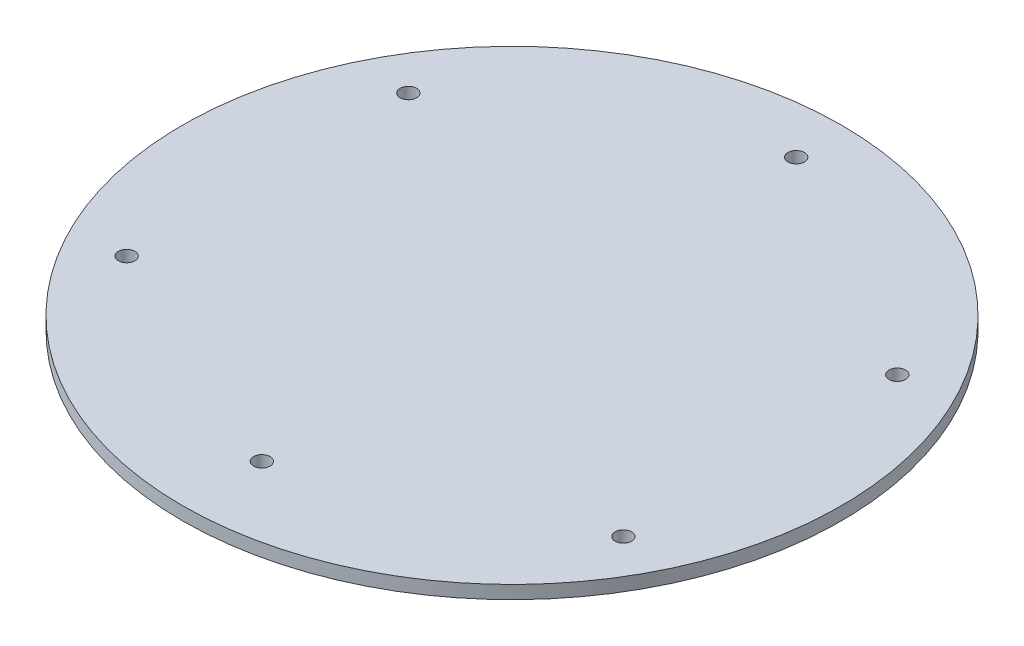
from build123d import *

# Parameters (mm, degrees)
SKETCH1_R           = 50
SKETCH1_R_2         = 1.25
BOSS_EXTRUDE5_DEPTH = 2


with BuildPart() as part:
    # Sketch1 → Boss-Extrude5 (new body)
    with BuildSketch(Plane(origin=(0, 0, 0), x_dir=(1, 0, 0), z_dir=(0, 1, 0))):
        with Locations(Location((1.95374507, -0.641277234, 0), (0, 0, 270))):
            Circle(SKETCH1_R)
        with Locations(Location((-35.124153771, 20.706959624, 0), (0, 0, 270))):
            Circle(SKETCH1_R_2, mode=Mode.SUBTRACT)
        with Locations(Location((2.729485392, 41.694547918, 0), (0, 0, 270))):
            Circle(SKETCH1_R_2, mode=Mode.SUBTRACT)
        with Locations(Location((38.980809936, 20.795006652, 0), (0, 0, 270))):
            Circle(SKETCH1_R_2, mode=Mode.SUBTRACT)
        with Locations(Location((39.459215619, -21.246901921, 0), (0, 0, 270))):
            Circle(SKETCH1_R_2, mode=Mode.SUBTRACT)
        with Locations(Location((2.153344808, -38.793165062, 0), (0, 0, 270))):
            Circle(SKETCH1_R_2, mode=Mode.SUBTRACT)
        with Locations(Location((-35.073319796, -22.07756112, 0), (0, 0, 270))):
            Circle(SKETCH1_R_2, mode=Mode.SUBTRACT)
    extrude(amount=BOSS_EXTRUDE5_DEPTH)


solid = part.part
